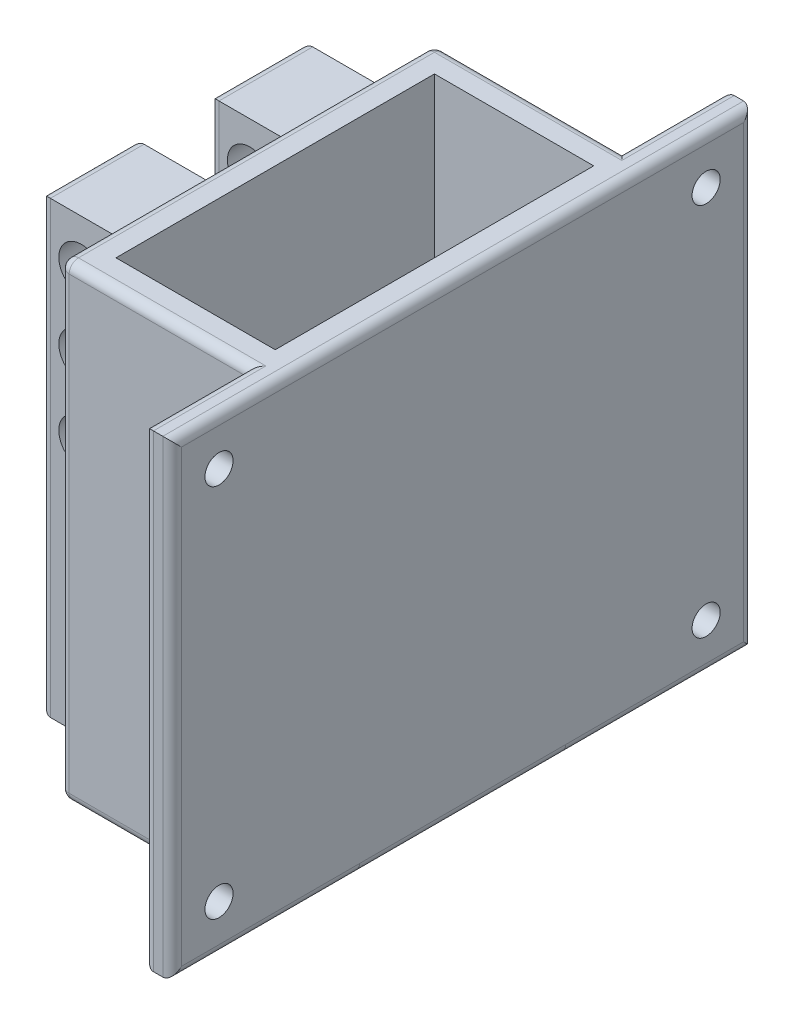
from build123d import *

# Parameters (mm, degrees)
CROQUIS2_W              = 23
CROQUIS2_H              = 40
SALIENTE_EXTRUIR1_DEPTH = 50
CROQUIS3_W              = 17
CROQUIS3_H              = 34
CORTAR_EXTRUIR1_DEPTH   = 45
REDONDEO1_R             = 1
CROQUIS5_W              = 20
CROQUIS5_H              = 50
CROQUIS5_R              = 1.5
SALIENTE_EXTRUIR3_DEPTH = 3
REDONDEO2_R             = 1
CROQUIS8_W              = 10
CROQUIS8_H              = 48
SALIENTE_EXTRUIR4_DEPTH = 8
CROQUIS9_R              = 2.4
CORTAR_EXTRUIR2_DEPTH   = 75.067536749
REDONDEO3_R             = 1


with BuildPart() as part:
    # Croquis2 → Saliente-Extruir1 (new body)
    with BuildSketch(Plane(origin=(0, 0, 0), x_dir=(1, 0, 0), z_dir=(0, 1, 0))):
        with Locations((-11.5, 20)):
            Rectangle(CROQUIS2_W, CROQUIS2_H)
    extrude(amount=SALIENTE_EXTRUIR1_DEPTH)

    # Croquis3 → Cortar-Extruir1 (cut)
    with BuildSketch(Plane(origin=(0, 50, 0), x_dir=(1, 0, 0), z_dir=(0, 1, 0))):
        with Locations((-11.5, 20)):
            Rectangle(CROQUIS3_W, CROQUIS3_H)
    extrude(amount=-CORTAR_EXTRUIR1_DEPTH, mode=Mode.SUBTRACT)

    # Redondeo1
    redondeo1_edges = [part.edges().sort_by_distance(p)[0] for p in [
        (-11.5, 0, 0),
        (-23, 0, -20),
        (-11.5, 0, -40),
        (0, 0, -20),
        (0, 25, 0),
        (-23, 25, 0),
        (-23, 25, -40),
        (0, 25, -40),
    ]]
    fillet(redondeo1_edges, radius=REDONDEO1_R)

    # Croquis5 → Saliente-Extruir3 (add)
    # profile 1 of 2: a face of its own
    with BuildSketch(Plane(origin=(0, 0, 0), x_dir=(0, 0, -1), z_dir=(1, 0, 0))):
        with Locations((-1, 25)):
            Rectangle(CROQUIS5_W, CROQUIS5_H)
        with Locations((-6, 45)):
            Circle(CROQUIS5_R, mode=Mode.SUBTRACT)
        with Locations((-6, 5)):
            Circle(CROQUIS5_R, mode=Mode.SUBTRACT)
    # profile 2 of 2: a face of its own
    with BuildSketch(Plane(origin=(0, 0, 0), x_dir=(0, 0, -1), z_dir=(1, 0, 0))):
        with Locations((41, 25)):
            Rectangle(CROQUIS5_W, CROQUIS5_H)
        with Locations((46, 5)):
            Circle(CROQUIS5_R, mode=Mode.SUBTRACT)
        with Locations((46, 45)):
            Circle(CROQUIS5_R, mode=Mode.SUBTRACT)
    extrude(amount=-SALIENTE_EXTRUIR3_DEPTH)

    # Redondeo2
    redondeo2_edges = [part.edges().sort_by_distance(p)[0] for p in [
        (-12.5, 50, 0),
        (-22.707106781, 50, -0.292893219),
        (-23, 50, -20),
        (-22.707106781, 50, -39.707106781),
        (-12.5, 50, -40),
        (-3, 0, -45),
        (-3, 25, -51),
        (-3, 50, -45.5),
        (0, 25, -51),
        (0, 0, -41),
        (0, 0, 1),
        (0, 25, 11),
        (-3, 25, 11),
        (0, 50, -20),
        (-3, 50, 5.5),
        (-3, 0, 5),
    ]]
    fillet(redondeo2_edges, radius=REDONDEO2_R)

    # Croquis8 → Saliente-Extruir4 (add)
    with BuildSketch(Plane.ZY.offset(23)):
        with Locations((-29, 25)):
            Rectangle(CROQUIS8_W, CROQUIS8_H)
        with Locations((-11, 25)):
            Rectangle(CROQUIS8_W, CROQUIS8_H)
    extrude(amount=SALIENTE_EXTRUIR4_DEPTH)

    # Croquis9 → Cortar-Extruir2 (cut, through all)
    with BuildSketch(Plane.XY.offset(-6)):
        with Locations((-26.7, 28)):
            Circle(CROQUIS9_R)
        with Locations((-26.7, 36)):
            Circle(CROQUIS9_R)
        with Locations((-26.7, 44)):
            Circle(CROQUIS9_R)
    extrude(amount=-CORTAR_EXTRUIR2_DEPTH, mode=Mode.SUBTRACT)

    # Redondeo3
    redondeo3_edges = [part.edges().sort_by_distance(p)[0] for p in [
        (-31, 25, -34),
        (-31, 1, -29),
        (-31, 25, -24),
        (-31, 49, -29),
        (-31, 25, -6),
        (-31, 49, -11),
        (-31, 25, -16),
        (-31, 1, -11),
    ]]
    fillet(redondeo3_edges, radius=REDONDEO3_R)


solid = part.part
